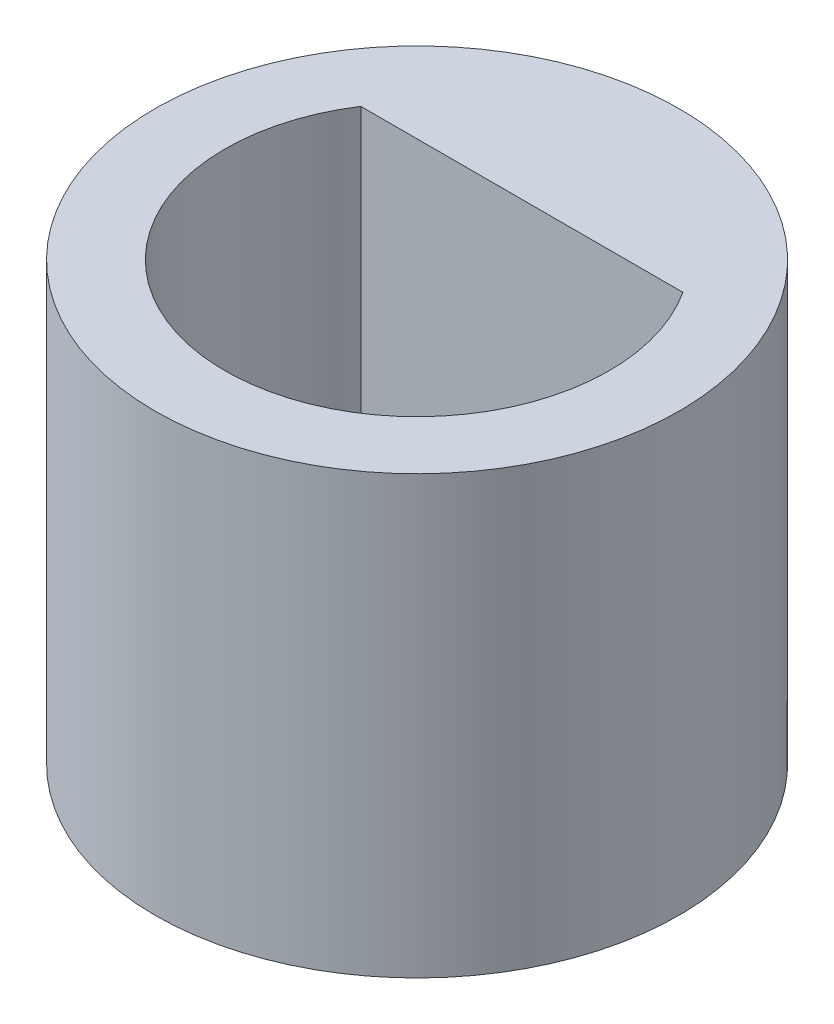
from build123d import *

# Parameters (mm, degrees)
SKETCH3_R           = 3
BOSS_EXTRUDE3_DEPTH = 5


with BuildPart() as part:
    # Sketch3 → Boss-Extrude3 (new body)
    with BuildSketch(Plane(origin=(0, 0, 0), x_dir=(1, 0, 0), z_dir=(0, 1, 0))):
        with Locations(Location((0, 0, 0), (0, 0, 270))):
            Circle(SKETCH3_R)
        with BuildLine():
            Line((-1.843908891, 1.2), (1.843908891, 1.2))
            ThreePointArc((1.843908891, 1.2), (0, -2.2), (-1.843908891, 1.2))
        make_face(mode=Mode.SUBTRACT)
    extrude(amount=BOSS_EXTRUDE3_DEPTH)


solid = part.part
